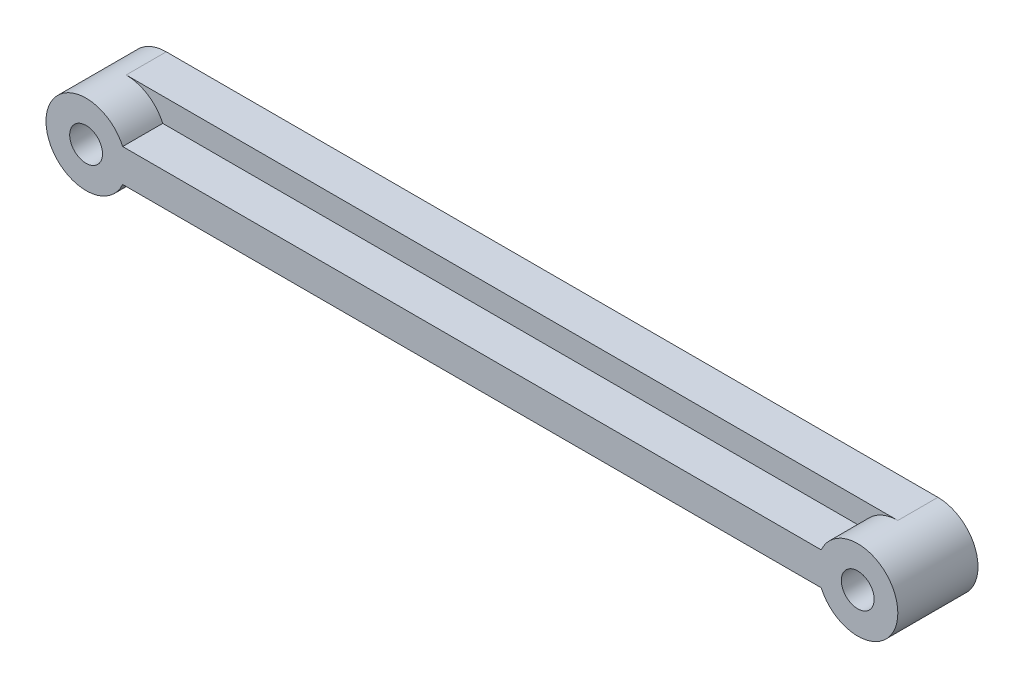
from build123d import *

# Parameters (mm, degrees)
SKETCH_1_R      = 0.819112032
EXTRUDE_1_DEPTH = 2
EXTRUDE_START   = 2
SKETCH_2_R      = 0.819112032
EXTRUDE_2_DEPTH = 2


with BuildPart() as part:
    # 草图1 → 凸台-拉伸1 (new body)
    with BuildSketch(Plane.XY):
        with BuildLine():
            Line((-45.884505443, 2), (-7.384505443, 2))
            ThreePointArc((-7.384505443, 2), (-5.384505443, 0), (-7.384505443, -2))
            Line((-7.384505443, -2), (-45.884505443, -2))
            ThreePointArc((-45.884505443, -2), (-47.884505443, 0), (-45.884505443, 2))
        make_face()
        with Locations((-45.884505443, 0)):
            Circle(SKETCH_1_R, mode=Mode.SUBTRACT)
        with Locations((-7.384505443, 0)):
            Circle(SKETCH_1_R, mode=Mode.SUBTRACT)
    extrude(amount=-EXTRUDE_1_DEPTH)

    # 草图2 → 凸台-拉伸2 (add)
    with BuildSketch(Plane.XY.offset(EXTRUDE_START)):
        with BuildLine():
            Line((-44.059935499, 0.819112032), (-9.209075386, 0.819112032))
            ThreePointArc((-9.209075386, 0.819112032), (-5.384505443, 0), (-9.209075386, -0.819112032))
            Line((-9.209075386, -0.819112032), (-44.059935499, -0.819112032))
            ThreePointArc((-44.059935499, -0.819112032), (-47.884505443, 0), (-44.059935499, 0.819112032))
        make_face()
        with Locations((-45.884505443, 0)):
            Circle(SKETCH_2_R, mode=Mode.SUBTRACT)
        with Locations((-7.384505443, 0)):
            Circle(SKETCH_2_R, mode=Mode.SUBTRACT)
    extrude(amount=-EXTRUDE_2_DEPTH)


solid = part.part
